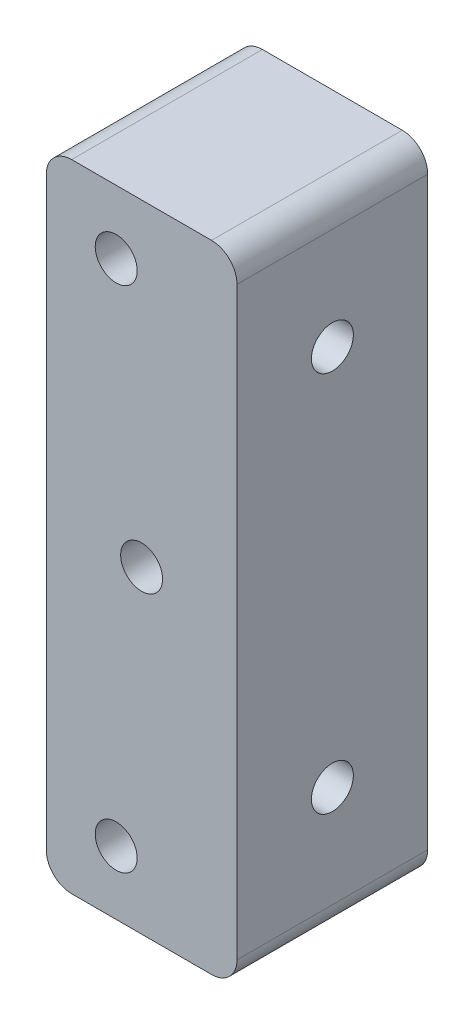
from build123d import *

# Parameters (mm, degrees)
SKETCH_1_W          = 15
SKETCH_1_H          = 50
SKETCH_1_R          = 1.65
EXTRUDE_1_DEPTH     = 15
SKETCH_2_R          = 1.65
CUT_EXTRUDE_1_DEPTH = 15
FILLET_1_R          = 2


with BuildPart() as part:
    # ｽｹｯﾁ1 → ﾎﾞｽ - 押し出し1 (new body)
    with BuildSketch(Plane.XY):
        with Locations((7.5, 25)):
            Rectangle(SKETCH_1_W, SKETCH_1_H)
        with Locations((5.5, 5)):
            Circle(SKETCH_1_R, mode=Mode.SUBTRACT)
        with Locations(Location((5.5, 45, 0), (0, 0, 180))):
            Circle(SKETCH_1_R, mode=Mode.SUBTRACT)
        with Locations((7.5, 25)):
            Circle(SKETCH_1_R, mode=Mode.SUBTRACT)
    extrude(amount=EXTRUDE_1_DEPTH)

    # ｽｹｯﾁ2 → ｶｯﾄ - 押し出し1 (cut)
    with BuildSketch(Plane.ZY):
        with Locations((7.5, 40)):
            Circle(SKETCH_2_R)
        with Locations((7.5, 10)):
            Circle(SKETCH_2_R)
    extrude(amount=-CUT_EXTRUDE_1_DEPTH, mode=Mode.SUBTRACT)

    # ﾌｨﾚｯﾄ1
    fillet_1_edges = [part.edges().sort_by_distance(p)[0] for p in [
        (0, 50, 7.5),
        (15, 50, 7.5),
        (15, 0, 7.5),
        (0, 0, 7.5),
    ]]
    fillet(fillet_1_edges, radius=FILLET_1_R)


solid = part.part
